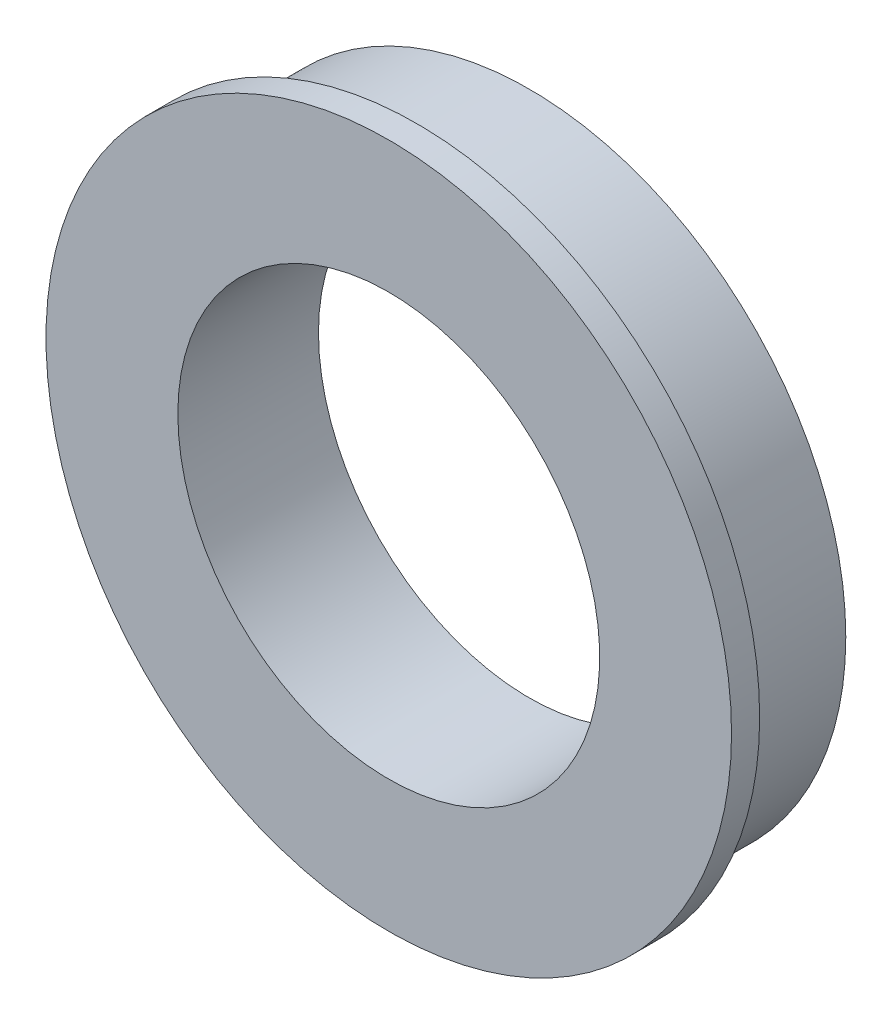
from build123d import *

# Parameters (mm, degrees)
SKETCH_1_R          = 9
EXTRUDE_1_DEPTH     = 4
SKETCH_2_R          = 9.75
EXTRUDE_2_DEPTH     = 0.8
SKETCH_3_R          = 6
CUT_EXTRUDE_1_DEPTH = 15.357054015


with BuildPart() as part:
    # 草图1 → 凸台-拉伸1 (new body)
    with BuildSketch(Plane.XY):
        Circle(SKETCH_1_R)
    extrude(amount=EXTRUDE_1_DEPTH)

    # 草图2 → 凸台-拉伸2 (add)
    with BuildSketch(Plane.XY.offset(4)):
        Circle(SKETCH_2_R)
    extrude(amount=-EXTRUDE_2_DEPTH)

    # 草图3 → 切除-拉伸1 (cut, through all)
    with BuildSketch(Plane(origin=(0, 0, 0), x_dir=(-1, 0, 0), z_dir=(0, 0, -1))):
        Circle(SKETCH_3_R)
    extrude(amount=-CUT_EXTRUDE_1_DEPTH, mode=Mode.SUBTRACT)


solid = part.part
